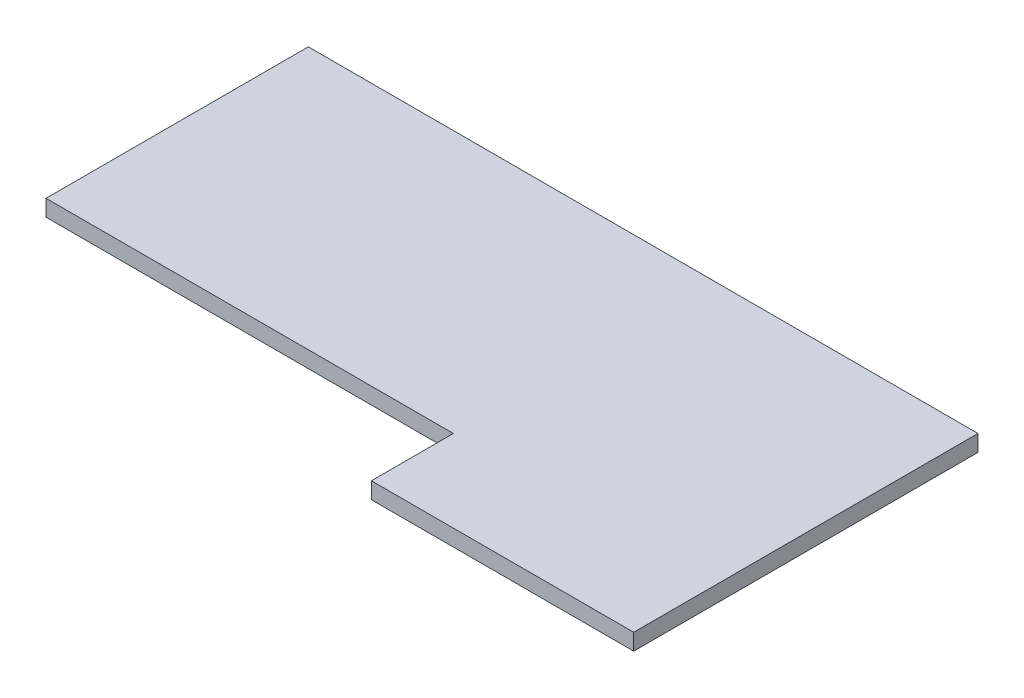
from build123d import *

# Parameters (mm, degrees)
BOSS_EXTRUDE1_DEPTH = 3.175


with BuildPart() as part:
    # Sketch1 → Boss-Extrude1 (new body)
    with BuildSketch(Plane(origin=(0, 0, 0), x_dir=(1, 0, 0), z_dir=(0, 1, 0))):
        Polygon((5.099333751, 0.684591182), (55.899333751, 0.684591182), (55.899333751, -65.990408818), (5.099333751, -65.990408818), (5.099333751, -50.115408818), (-73.783914514, -50.115408818), (-73.783914514, 0.684591182), align=None)
    extrude(amount=BOSS_EXTRUDE1_DEPTH)


solid = part.part
